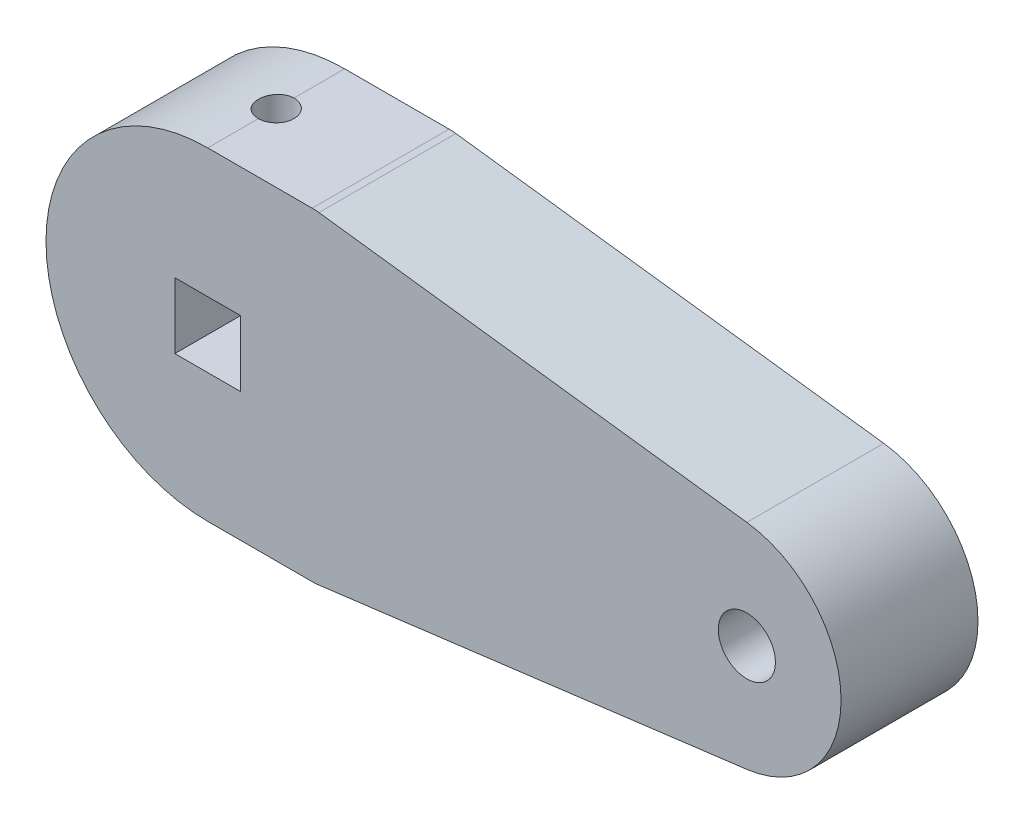
from build123d import *

# Parameters (mm, degrees)
SKETCH1_W                       = 6.1
SKETCH1_H                       = 6.1
BOSS_EXTRUDE1_DEPTH             = 12.7
TAP_DRILL_FOR_M4X0_7_TAP1_D     = 3.3
TAP_DRILL_FOR_M4X0_7_TAP1_DEPTH = 11.95
M5_CLEARANCE_HOLE1_D            = 5.3
FILLET1_R                       = 5


with BuildPart() as part:
    # Sketch1 → Boss-Extrude1 (new body)
    with BuildSketch(Plane.XY):
        with BuildLine():
            Line((50, 9.920327772), (10, 15))
            Line((10, 15), (0, 15))
            ThreePointArc((0, 15), (-15, 0), (0, -15))
            Line((0, -15), (10, -15))
            Line((10, -15), (50, -9.920327772))
            ThreePointArc((50, -9.920327772), (58.740199663, 0), (50, 9.920327772))
        make_face()
        Rectangle(SKETCH1_W, SKETCH1_H, mode=Mode.SUBTRACT)
    extrude(amount=BOSS_EXTRUDE1_DEPTH)

    # Tap Drill for M4x0.7 Tap1
    with Locations(Plane(origin=(0, 15, 6.35), x_dir=(0, 0, 1), z_dir=(0, 1, 0))):
        with Locations((0, 0)):
            Hole(TAP_DRILL_FOR_M4X0_7_TAP1_D / 2, depth=TAP_DRILL_FOR_M4X0_7_TAP1_DEPTH)

    # M5 Clearance Hole1 (through all)
    with Locations(Plane(origin=(50, 0, 0), x_dir=(-1, 0, 0), z_dir=(0, 0, -1))):
        with Locations((0, 0)):
            Hole(M5_CLEARANCE_HOLE1_D / 2)

    # Fillet1
    fillet1_edges = [part.edges().sort_by_distance(p)[0] for p in [
        (10, 15, 6.35),
        (10, -15, 6.35),
    ]]
    fillet(fillet1_edges, radius=FILLET1_R)


solid = part.part
